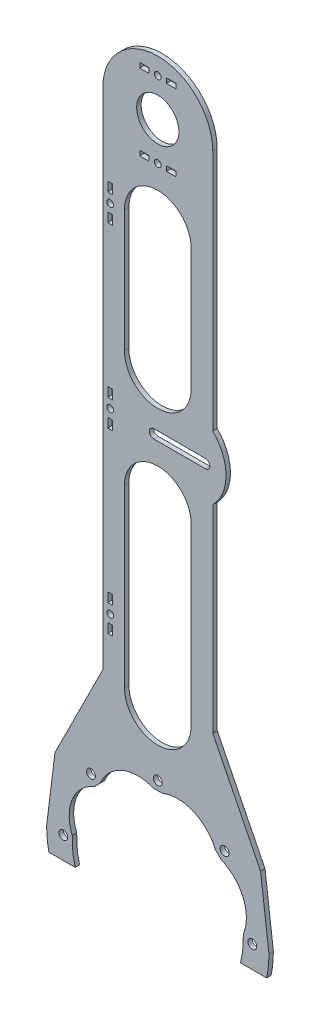
from build123d import *

# Parameters (mm, degrees)
SKETCH_1_R      = 2
SKETCH_1_R_2    = 9.5
SKETCH_1_R_3    = 1.5
SKETCH_1_W      = 4.2
SKETCH_1_H      = 2.2
SKETCH_1_W_2    = 2.2
SKETCH_1_H_2    = 4.2
EXTRUDE_1_DEPTH = 2


with BuildPart() as part:
    # 草图1 → 凸台-拉伸1 (new body)
    with BuildSketch(Plane.XY):
        with BuildLine():
            Line((37.188144312, -134.964533236), (48.99702068, -134.964533236))
            ThreePointArc((48.99702068, -134.964533236), (49.748623267, -130.007441715), (50, -125))
            Line((50, -125), (46.25, -94.741478673))
            Line((46.25, -94.741478673), (24.741807932, -51.739753072))
            Line((24.741807932, -51.739753072), (24.741807932, 0))
            Line((24.741807932, 0), (24.741807932, 37.305457961))
            ThreePointArc((24.741807932, 37.305457961), (30.688954295, 51.663139366), (24.741807932, 66.020820772))
            Line((24.741807932, 66.020820772), (24.741807932, 175))
            ThreePointArc((24.741807932, 175), (0, 199.741807932), (-24.741807932, 175))
            Line((-24.741807932, 175), (-24.741807932, 0))
            Line((-24.741807932, 0), (-24.741807932, -51.739753072))
            Line((-24.741807932, -51.739753072), (-46.25, -94.741478673))
            Line((-46.25, -94.741478673), (-50, -125))
            ThreePointArc((-50, -125), (-49.748623375, -130.007441694), (-48.997021107, -134.964533236))
            Line((-48.997021107, -134.964533236), (-37.188144312, -134.964533236))
            ThreePointArc((-37.188144312, -134.964533236), (-38.041933638, -130.921257055), (-38.457440916, -126.809761925))
            ThreePointArc((-38.457440916, -126.809761925), (-38.5, -125), (-38.457440916, -123.190238075))
            ThreePointArc((-38.457440916, -123.190238075), (-38.457808555, -109.071427319), (-28.474561687, -99.087660532))
            ThreePointArc((-28.474561687, -99.087660532), (-27.223611076, -97.776388924), (-25.912339468, -96.525438313))
            ThreePointArc((-25.912339468, -96.525438313), (-15.928572681, -86.542191445), (-1.809761925, -86.542559084))
            ThreePointArc((-1.809761925, -86.542559084), (0, -86.5), (1.809761925, -86.542559084))
            ThreePointArc((1.809761925, -86.542559084), (15.928572681, -86.542191445), (25.912339468, -96.525438313))
            ThreePointArc((25.912339468, -96.525438313), (27.223611076, -97.776388924), (28.474561687, -99.087660532))
            ThreePointArc((28.474561687, -99.087660532), (38.457808555, -109.071427319), (38.457440916, -123.190238075))
            ThreePointArc((38.457440916, -123.190238075), (38.278220279, -129.126481825), (37.188144312, -134.964533236))
        make_face()
        with Locations((-42.5, -125)):
            Circle(SKETCH_1_R, mode=Mode.SUBTRACT)
        with Locations((-30.0520382, -94.9479618)):
            Circle(SKETCH_1_R, mode=Mode.SUBTRACT)
        with Locations((0, -82.5)):
            Circle(SKETCH_1_R, mode=Mode.SUBTRACT)
        with Locations((30.0520382, -94.9479618)):
            Circle(SKETCH_1_R, mode=Mode.SUBTRACT)
        with Locations((42.5, -125)):
            Circle(SKETCH_1_R, mode=Mode.SUBTRACT)
        with Locations((0, 175)):
            Circle(SKETCH_1_R_2, mode=Mode.SUBTRACT)
        with Locations((0, 192.120903966)):
            Circle(SKETCH_1_R_3, mode=Mode.SUBTRACT)
        with Locations(Location((0, 157.879096034, 0), (0, 0, 180))):
            Circle(SKETCH_1_R_3, mode=Mode.SUBTRACT)
        with Locations((-21.392054648, -28.335407124)):
            Circle(SKETCH_1_R_3, mode=Mode.SUBTRACT)
        with Locations((-21.392054648, 51.664592876)):
            Circle(SKETCH_1_R_3, mode=Mode.SUBTRACT)
        with Locations((-21.392054648, 131.664592876)):
            Circle(SKETCH_1_R_3, mode=Mode.SUBTRACT)
        with Locations((6, 192.120903966)):
            Rectangle(SKETCH_1_W, SKETCH_1_H, mode=Mode.SUBTRACT)
        with BuildLine():
            Line((21.41471253, 49.663139366), (-1.809761925, 49.663139366))
            ThreePointArc((-1.809761925, 49.663139366), (-3.809761925, 51.663139366), (-1.809761925, 53.663139366))
            Line((-1.809761925, 53.663139366), (21.41471253, 53.663139366))
            ThreePointArc((21.41471253, 53.663139366), (23.41471253, 51.663139366), (21.41471253, 49.663139366))
        make_face(mode=Mode.SUBTRACT)
        with Locations((-6, 192.120903966)):
            Rectangle(SKETCH_1_W, SKETCH_1_H, mode=Mode.SUBTRACT)
        with Locations((-21.392054648, 57.664592876)):
            Rectangle(SKETCH_1_W_2, SKETCH_1_H_2, mode=Mode.SUBTRACT)
        with Locations((-6, 157.879096034)):
            Rectangle(SKETCH_1_W, SKETCH_1_H, mode=Mode.SUBTRACT)
        with Locations((6, 157.879096034)):
            Rectangle(SKETCH_1_W, SKETCH_1_H, mode=Mode.SUBTRACT)
        with BuildLine():
            Line((-15, -53.7654447), (-15, 25))
            ThreePointArc((-15, 25), (0, 40), (15, 25))
            Line((15, 25), (15, -53.7654447))
            ThreePointArc((15, -53.7654447), (0, -68.7654447), (-15, -53.7654447))
        make_face(mode=Mode.SUBTRACT)
        with Locations((-21.392054648, -22.335407124)):
            Rectangle(SKETCH_1_W_2, SKETCH_1_H_2, mode=Mode.SUBTRACT)
        with Locations((-21.392054648, -34.335407124)):
            Rectangle(SKETCH_1_W_2, SKETCH_1_H_2, mode=Mode.SUBTRACT)
        with Locations((-21.392054648, 45.664592876)):
            Rectangle(SKETCH_1_W_2, SKETCH_1_H_2, mode=Mode.SUBTRACT)
        with BuildLine():
            Line((-15, 77.43505255), (-15, 132.43505255))
            ThreePointArc((-15, 132.43505255), (0, 147.43505255), (15, 132.43505255))
            Line((15, 132.43505255), (15, 77.43505255))
            ThreePointArc((15, 77.43505255), (0, 62.43505255), (-15, 77.43505255))
        make_face(mode=Mode.SUBTRACT)
        with Locations((-21.392054648, 137.664592876)):
            Rectangle(SKETCH_1_W_2, SKETCH_1_H_2, mode=Mode.SUBTRACT)
        with Locations((-21.392054648, 125.664592876)):
            Rectangle(SKETCH_1_W_2, SKETCH_1_H_2, mode=Mode.SUBTRACT)
    extrude(amount=EXTRUDE_1_DEPTH)


solid = part.part
